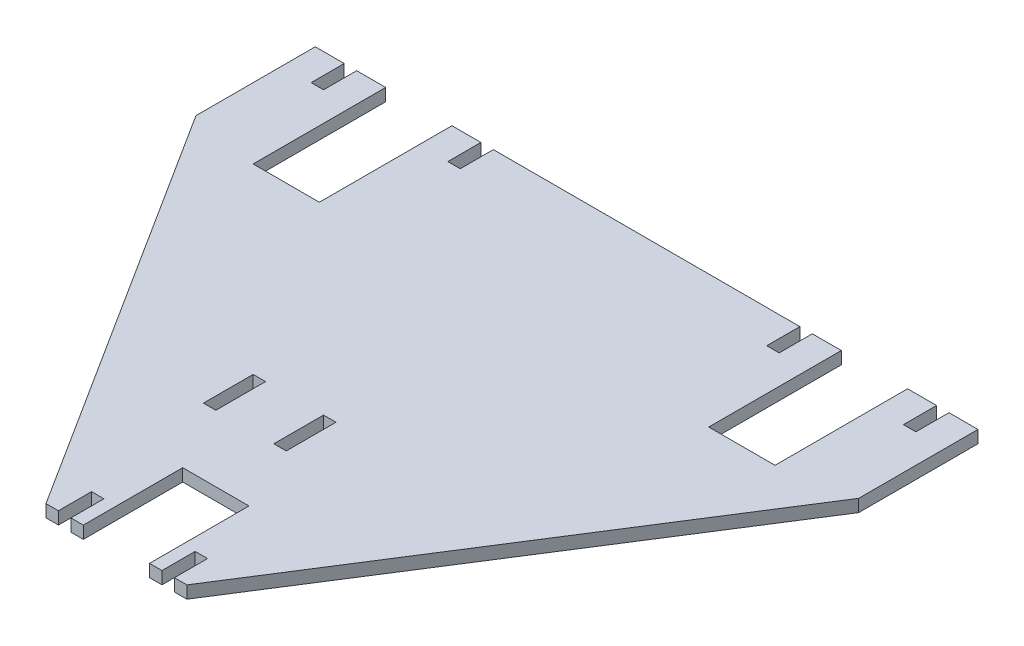
from build123d import *

# Parameters (mm, degrees)
BOSS_EXTRUDE1_DEPTH = 4.7625
SKETCH2_W           = 4.7625
SKETCH2_H           = 19.05
CUT_EXTRUDE1_DEPTH  = 163.709069834


with BuildPart() as part:
    # Sketch1 → Boss-Extrude1 (new body)
    with BuildSketch(Plane(origin=(0, 0, 0), x_dir=(1, 0, 0), z_dir=(0, 1, 0))):
        Polygon((12.7, -63.5), (-12.7, -63.5), (-12.7, -101.6), (-17.4625, -101.6), (-17.4625, -88.9), (-22.225, -88.9), (-22.225, -101.6), (-26.9875, -101.6), (-127, 55.88), (-127, 101.6), (-115.8875, 101.6), (-115.8875, 88.9), (-111.125, 88.9), (-111.125, 101.6), (-100.0125, 101.6), (-100.0125, 50.8), (-74.6125, 50.8), (-74.6125, 101.6), (-63.5, 101.6), (-63.5, 88.9), (-58.7375, 88.9), (-58.7375, 101.6), (58.7375, 101.6), (58.7375, 88.9), (63.5, 88.9), (63.5, 101.6), (74.6125, 101.6), (74.6125, 50.8), (100.0125, 50.8), (100.0125, 101.6), (111.125, 101.6), (111.125, 88.9), (115.8875, 88.9), (115.8875, 101.6), (127, 101.6), (127, 55.88), (26.9875, -101.6), (22.225, -101.6), (22.225, -88.9), (17.4625, -88.9), (17.4625, -101.6), (12.7, -101.6), align=None)
    extrude(amount=BOSS_EXTRUDE1_DEPTH)

    # Sketch2 → Cut-Extrude1 (cut, through all)
    with BuildSketch(Plane(origin=(0, 4.7625, 0), x_dir=(1, 0, 0), z_dir=(0, 1, 0))):
        with Locations((-27.78125, -28.575)):
            Rectangle(SKETCH2_W, SKETCH2_H)
        with Locations((-0.79375, -28.575)):
            Rectangle(SKETCH2_W, SKETCH2_H)
    extrude(amount=-CUT_EXTRUDE1_DEPTH, mode=Mode.SUBTRACT)


solid = part.part
